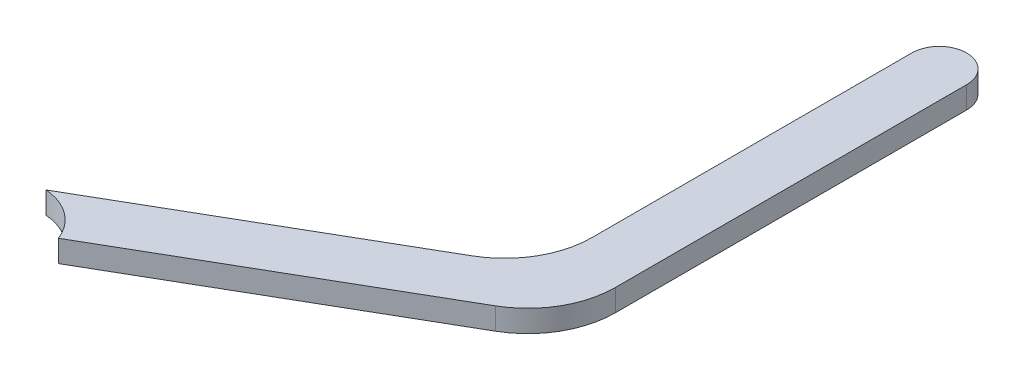
from build123d import *

# Parameters (mm, degrees)
BOSS_EXTRUDE1_DEPTH = 6.35
CUT_EXTRUDE1_DEPTH  = 158.804246512
FILLET1_R           = 25.4


with BuildPart() as part:
    # Sketch1 → Boss-Extrude1 (new body)
    with BuildSketch(Plane(origin=(0, 0, 0), x_dir=(1, 0, 0), z_dir=(0, 1, 0))):
        with BuildLine():
            Line((7.9375, 111.6203), (7.9375, -4.582717762))
            Line((7.9375, -4.582717762), (-90.893507667, -61.642826643))
            ThreePointArc((-90.893507667, -61.642826643), (-101.73633431, -58.7375), (-98.831007667, -47.894673357))
            Line((-98.831007667, -47.894673357), (-7.9375, 4.582717762))
            Line((-7.9375, 4.582717762), (-7.9375, 111.6203))
            ThreePointArc((-7.9375, 111.6203), (0, 119.5578), (7.9375, 111.6203))
        make_face()
    extrude(amount=BOSS_EXTRUDE1_DEPTH)

    # Sketch2 → Cut-Extrude1 (cut, through all)
    with BuildSketch(Plane(origin=(0, 6.35, 0), x_dir=(1, 0, 0), z_dir=(0, 1, 0))):
        with BuildLine():
            Line((-90.893507667, -61.642826643), (-84.931832215, -58.200851716))
            ThreePointArc((-84.931832215, -58.200851716), (-90.389422779, -51.035617044), (-98.831007667, -47.894673357))
            ThreePointArc((-98.831007667, -47.894673357), (-101.73633431, -58.7375), (-90.893507667, -61.642826643))
        make_face()
    extrude(amount=-CUT_EXTRUDE1_DEPTH, mode=Mode.SUBTRACT)

    # Fillet1
    fillet1_edges = [part.edges().sort_by_distance(p)[0] for p in [
        (7.9375, 3.175, 4.582717762),
        (-7.9375, 3.175, -4.582717762),
    ]]
    fillet(fillet1_edges, radius=FILLET1_R)


solid = part.part
